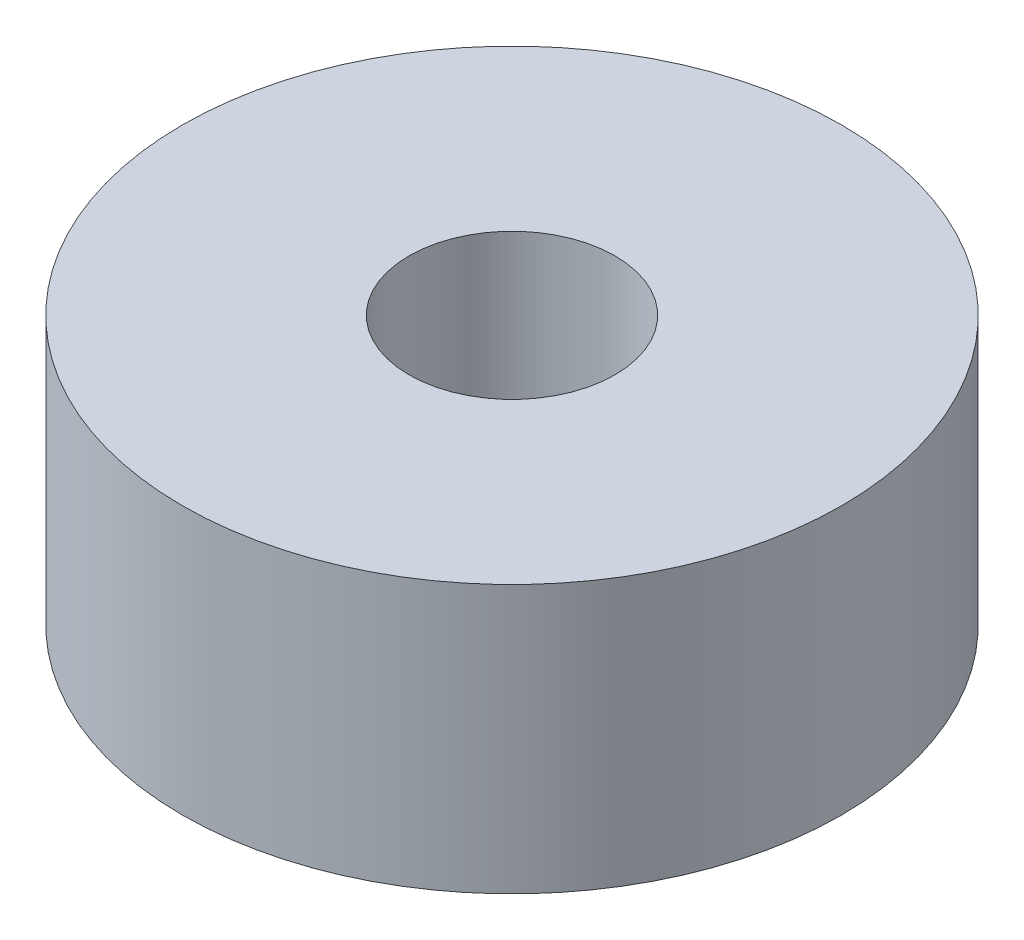
from build123d import *

# Parameters (mm, degrees)
SKETCH_1_R      = 8
SKETCH_1_R_2    = 2.5
EXTRUDE_1_DEPTH = 6.5


with BuildPart() as part:
    # Эскиз1 → Бобышка-Вытянуть1 (new body)
    with BuildSketch(Plane(origin=(0, 0, 0), x_dir=(1, 0, 0), z_dir=(0, 1, 0))):
        with Locations(Location((0, 0, 0), (0, 0, 90))):
            Circle(SKETCH_1_R)
        with Locations(Location((0, 0, 0), (0, 0, 90))):
            Circle(SKETCH_1_R_2, mode=Mode.SUBTRACT)
    extrude(amount=EXTRUDE_1_DEPTH)


solid = part.part
